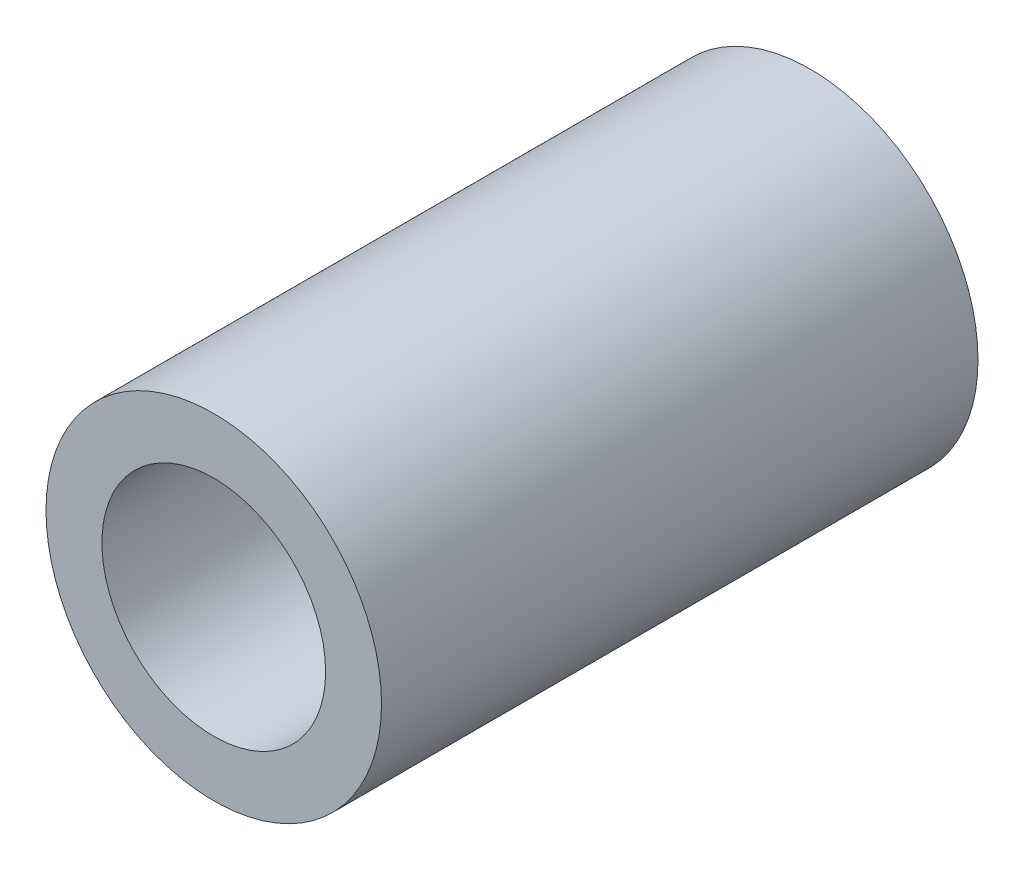
from build123d import *

# Parameters (mm, degrees)
SKETCH1_R           = 9
SKETCH1_R_2         = 6
BOSS_EXTRUDE1_DEPTH = 16


with BuildPart() as part:
    # Sketch1 → Boss-Extrude1 (new, symmetric)
    with BuildSketch(Plane.XY):
        Circle(SKETCH1_R)
        Circle(SKETCH1_R_2, mode=Mode.SUBTRACT)
    extrude(amount=BOSS_EXTRUDE1_DEPTH, both=True)


solid = part.part
